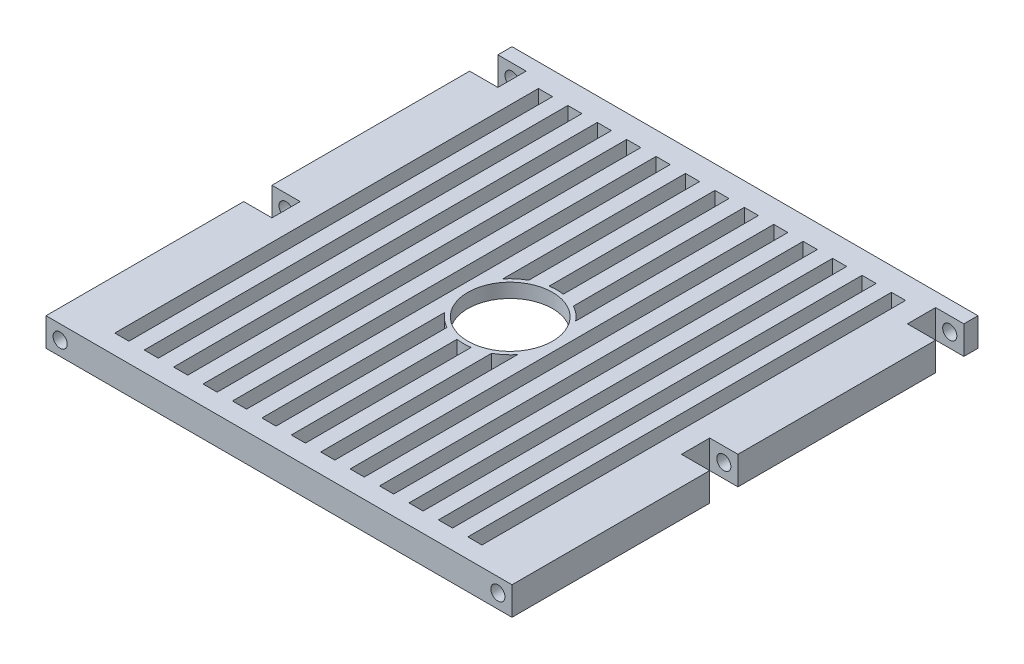
from build123d import *

# Parameters (mm, degrees)
ESQUISSE1_W             = 5
ESQUISSE1_H             = 150
ESQUISSE1_R             = 15
BASE_DEPTH              = 10
VIDE_VIS_DEPTH          = 127.219055614
VIDE_VIS_DEPTH_BACK     = 127.219055614
ESQUISSE5_R             = 2.5
ESQUISSE6_W             = 130
ESQUISSE6_H             = 150
ENL_V_MAT_EXTRU_6_DEPTH = 5


with BuildPart() as part:
    # Esquisse1 → BASE (new body)
    with BuildSketch(Plane(origin=(0, 0, 0), x_dir=(1, 0, 0), z_dir=(0, 1, 0))):
        Polygon((-82.5, 82.5), (-82.5, 77.5), (-72.5, 77.5), (-72.5, 67.5), (-82.5, 67.5), (-82.5, -2.5), (-72.5, -2.5), (-72.5, -12.5), (-82.5, -12.5), (-82.5, -82.5), (82.5, -82.5), (82.5, -12.5), (72.5, -12.5), (72.5, -2.5), (82.5, -2.5), (82.5, 67.5), (72.5, 67.5), (72.5, 77.5), (82.5, 77.5), (82.5, 82.5), align=None)
        with BuildLine():
            ThreePointArc((-12.916666667, -10.915030923), (-10.627210874, -13.27000839), (-7.916666667, -15.124860621))
            Line((-7.916666667, -15.124860621), (-7.916666667, -75.648107225))
            Line((-7.916666667, -75.648107225), (-12.916666667, -75.648107225))
            Line((-12.916666667, -75.648107225), (-12.916666667, -10.915030923))
        make_face(mode=Mode.SUBTRACT)
        with Locations((-62.5, -0.648107225)):
            Rectangle(ESQUISSE1_W, ESQUISSE1_H, mode=Mode.SUBTRACT)
        with Locations((-52.083333333, -0.648107225)):
            Rectangle(ESQUISSE1_W, ESQUISSE1_H, mode=Mode.SUBTRACT)
        with Locations((-41.666666667, -0.648107225)):
            Rectangle(ESQUISSE1_W, ESQUISSE1_H, mode=Mode.SUBTRACT)
        with Locations((-31.25, -0.648107225)):
            Rectangle(ESQUISSE1_W, ESQUISSE1_H, mode=Mode.SUBTRACT)
        with Locations((-20.833333333, -0.648107225)):
            Rectangle(ESQUISSE1_W, ESQUISSE1_H, mode=Mode.SUBTRACT)
        with Locations(Location((0, -0.648107225, 0), (0, 0, 270))):
            Circle(ESQUISSE1_R, mode=Mode.SUBTRACT)
        with BuildLine():
            Line((-2.5, -75.648107225), (-2.5, -16.957613655))
            ThreePointArc((-2.5, -16.957613655), (0, -17.148107225), (2.5, -16.957613655))
            Line((2.5, -16.957613655), (2.5, -75.648107225))
            Line((2.5, -75.648107225), (-2.5, -75.648107225))
        make_face(mode=Mode.SUBTRACT)
        with BuildLine():
            Line((7.916666667, -75.648107225), (7.916666667, -15.124860621))
            ThreePointArc((7.916666667, -15.124860621), (10.627210874, -13.27000839), (12.916666667, -10.915030923))
            Line((12.916666667, -10.915030923), (12.916666667, -75.648107225))
            Line((12.916666667, -75.648107225), (7.916666667, -75.648107225))
        make_face(mode=Mode.SUBTRACT)
        with BuildLine():
            Line((-12.916666667, 9.618816473), (-12.916666667, 74.351892775))
            Line((-12.916666667, 74.351892775), (-7.916666667, 74.351892775))
            Line((-7.916666667, 74.351892775), (-7.916666667, 13.828646171))
            ThreePointArc((-7.916666667, 13.828646171), (-10.627210874, 11.973793941), (-12.916666667, 9.618816473))
        make_face(mode=Mode.SUBTRACT)
        with Locations((20.833333333, -0.648107225)):
            Rectangle(ESQUISSE1_W, ESQUISSE1_H, mode=Mode.SUBTRACT)
        with Locations((31.25, -0.648107225)):
            Rectangle(ESQUISSE1_W, ESQUISSE1_H, mode=Mode.SUBTRACT)
        with Locations((41.666666667, -0.648107225)):
            Rectangle(ESQUISSE1_W, ESQUISSE1_H, mode=Mode.SUBTRACT)
        with Locations((52.083333333, -0.648107225)):
            Rectangle(ESQUISSE1_W, ESQUISSE1_H, mode=Mode.SUBTRACT)
        with Locations((62.5, -0.648107225)):
            Rectangle(ESQUISSE1_W, ESQUISSE1_H, mode=Mode.SUBTRACT)
        with BuildLine():
            Line((-2.5, 15.661399205), (-2.5, 74.351892775))
            Line((-2.5, 74.351892775), (2.5, 74.351892775))
            Line((2.5, 74.351892775), (2.5, 15.661399205))
            ThreePointArc((2.5, 15.661399205), (0, 15.851892775), (-2.5, 15.661399205))
        make_face(mode=Mode.SUBTRACT)
        with BuildLine():
            Line((12.916666667, 74.351892775), (12.916666667, 9.618816473))
            ThreePointArc((12.916666667, 9.618816473), (10.627210874, 11.973793941), (7.916666667, 13.828646171))
            Line((7.916666667, 13.828646171), (7.916666667, 74.351892775))
            Line((7.916666667, 74.351892775), (12.916666667, 74.351892775))
        make_face(mode=Mode.SUBTRACT)
    extrude(amount=BASE_DEPTH)

    # Esquisse5 → VIDE VIS (cut, two sides: drawn at the far end of the back side and taken through both)
    with BuildSketch(Plane(origin=(0, 0, 12.5), x_dir=(-1, 0, 0), z_dir=(0, 0, -1)).offset(-VIDE_VIS_DEPTH_BACK)):
        with Locations((-77.5, 5)):
            Circle(ESQUISSE5_R)
        with Locations(Location((77.5, 5, 0), (0, 0, 180))):
            Circle(ESQUISSE5_R)
    extrude(amount=VIDE_VIS_DEPTH + VIDE_VIS_DEPTH_BACK, mode=Mode.SUBTRACT)

    # Esquisse6 → Enlèv. mat.-Extru.6 (cut)
    with BuildSketch(Plane.XZ):
        with Locations((0, 0.648107225)):
            Rectangle(ESQUISSE6_W, ESQUISSE6_H)
    extrude(amount=-ENL_V_MAT_EXTRU_6_DEPTH, mode=Mode.SUBTRACT)


solid = part.part
